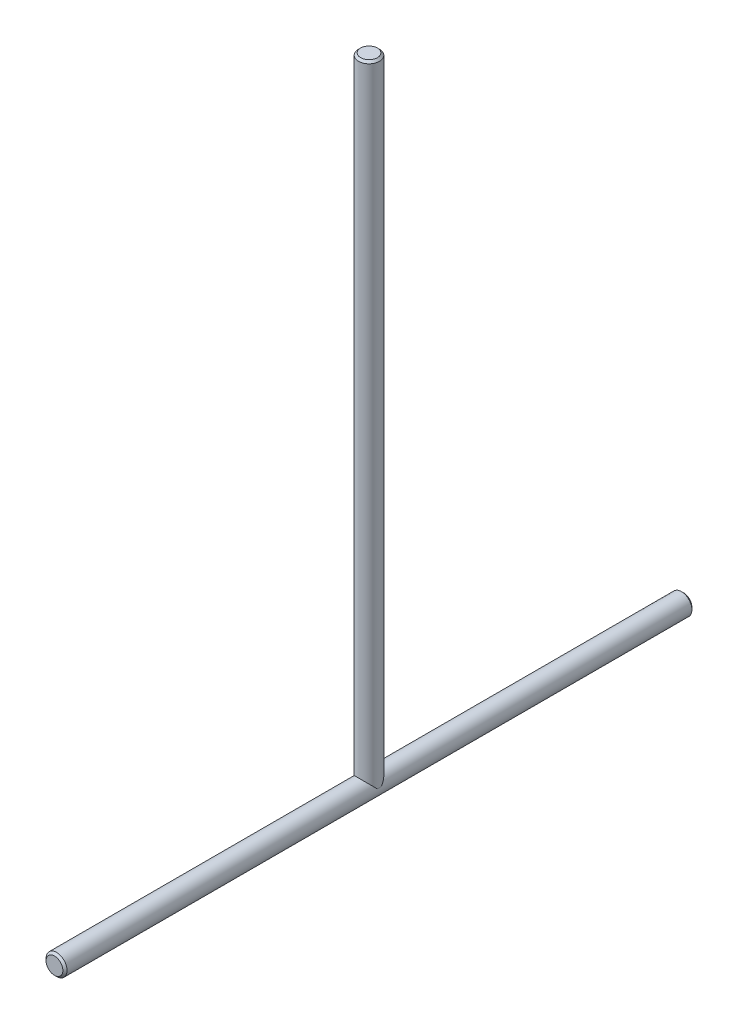
from build123d import *

# Parameters (mm, degrees)
SKETCH2_R           = 5
BOSS_EXTRUDE1_DEPTH = 150
CHAMFER1_SIZE       = 1


with BuildPart() as part:
    # Sketch1 → Revolve1 (revolve)
    with BuildSketch(Plane.XY, mode=Mode.PRIVATE) as revolve1_sk:
        Polygon((0, 0), (0, 302), (4, 302), (5, 301), (5, 1), (4, 0), align=None)
    revolve(revolve1_sk.sketch.rotate(Axis((0, 0, 0), (0, 1, 0)), 90), axis=Axis((0, 0, 0), (0, 1, 0)))

    # Sketch2 → Boss-Extrude1 (add, symmetric)
    with BuildSketch(Plane.XY):
        Circle(SKETCH2_R)
    extrude(amount=BOSS_EXTRUDE1_DEPTH, both=True)

    # Chamfer1
    chamfer1_edges = [part.edges().sort_by_distance(p)[0] for p in [
        (-5, 0, -150),
        (-5, 0, 150),
    ]]
    chamfer(chamfer1_edges, length=CHAMFER1_SIZE)


solid = part.part
